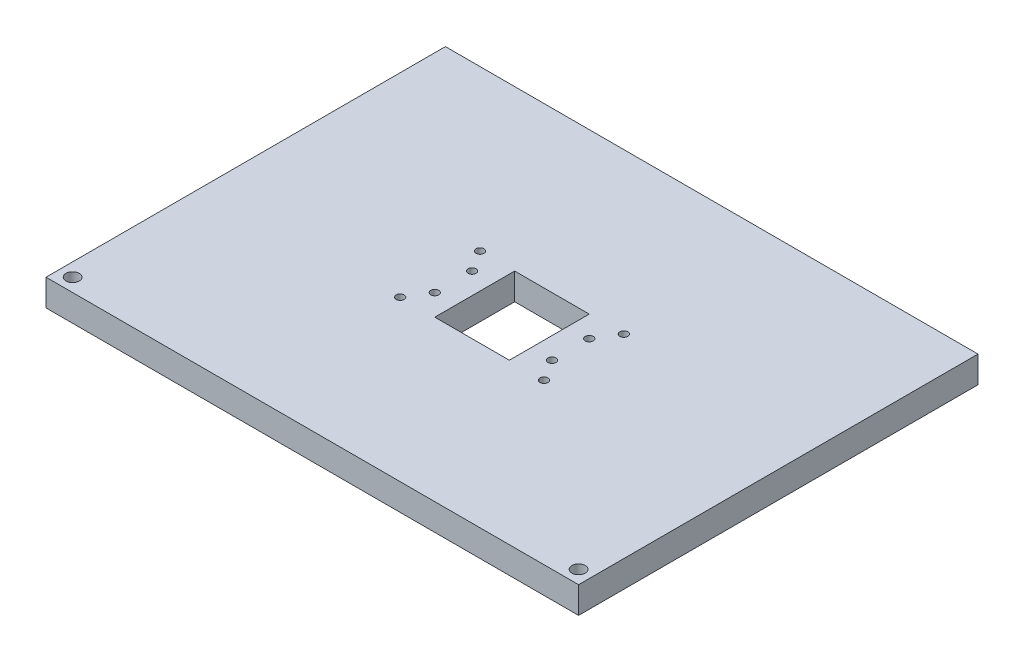
from build123d import *

# Parameters (mm, degrees)
SKETCH1_W           = 200
SKETCH1_H           = 60
BOSS_EXTRUDE1_DEPTH = 10
SKETCH2_W           = 200
SKETCH2_H           = 10
BOSS_EXTRUDE2_DEPTH = 140
SKETCH3_R           = 15.5
CUT_EXTRUDE1_DEPTH  = 60
SKETCH7_W           = 10
SKETCH7_H           = 30
CUT_EXTRUDE4_DEPTH  = 30
SKETCH9_R           = 1.5
SKETCH9_R_2         = 2.5
CUT_EXTRUDE6_DEPTH  = 20
SKETCH10_W          = 33.76561095
SKETCH10_H          = 62.627783557
CUT_EXTRUDE7_DEPTH  = 130
SKETCH11_W          = 8
SKETCH11_H          = 30
CUT_EXTRUDE8_DEPTH  = 30


with BuildPart() as part:
    # Sketch1 → Boss-Extrude1 (new body)
    with BuildSketch(Plane.XY):
        Rectangle(SKETCH1_W, SKETCH1_H)
    extrude(amount=BOSS_EXTRUDE1_DEPTH)

    # Sketch2 → Boss-Extrude2 (add)
    with BuildSketch(Plane(origin=(0, 0, 0), x_dir=(-1, 0, 0), z_dir=(0, 0, -1))):
        with Locations((0, -25)):
            Rectangle(SKETCH2_W, SKETCH2_H)
    extrude(amount=BOSS_EXTRUDE2_DEPTH)

    # Sketch3 → Cut-Extrude1 (cut)
    with BuildSketch(Plane.XY.offset(10)):
        with Locations((0, 5)):
            Circle(SKETCH3_R)
        with Locations((60, 5)):
            Circle(SKETCH3_R)
        with Locations((-60, 5)):
            Circle(SKETCH3_R)
    extrude(amount=-CUT_EXTRUDE1_DEPTH, mode=Mode.SUBTRACT)

    # Sketch7 → Cut-Extrude4 (cut)
    with BuildSketch(Plane(origin=(0, -20, 0), x_dir=(1, 0, 0), z_dir=(0, 1, 0))):
        with Locations((9, 65)):
            Rectangle(SKETCH7_W, SKETCH7_H)
        with Locations((-9, 65)):
            Rectangle(SKETCH7_W, SKETCH7_H)
    extrude(amount=-CUT_EXTRUDE4_DEPTH, mode=Mode.SUBTRACT)

    # Sketch9 → Cut-Extrude6 (cut)
    with BuildSketch(Plane(origin=(0, -20, 0), x_dir=(1, 0, 0), z_dir=(0, 1, 0))):
        with Locations(Location((-27, 80, 0), (0, 0, 270))):
            Circle(SKETCH9_R)
        with Locations(Location((27, 80, 0), (0, 0, 270))):
            Circle(SKETCH9_R)
        with Locations(Location((27, 50, 0), (0, 0, 270))):
            Circle(SKETCH9_R)
        with Locations(Location((-27, 50, 0), (0, 0, 270))):
            Circle(SKETCH9_R)
        with Locations(Location((-22, 72, 0), (0, 0, 270))):
            Circle(SKETCH9_R)
        with Locations(Location((-22, 58, 0), (0, 0, 270))):
            Circle(SKETCH9_R)
        with Locations(Location((22, 72, 0), (0, 0, 270))):
            Circle(SKETCH9_R)
        with Locations(Location((22, 58, 0), (0, 0, 270))):
            Circle(SKETCH9_R)
        with Locations(Location((95, -5, 0), (0, 0, 270))):
            Circle(SKETCH9_R_2)
        with Locations(Location((-95, -5, 0), (0, 0, 270))):
            Circle(SKETCH9_R_2)
    extrude(amount=-CUT_EXTRUDE6_DEPTH, mode=Mode.SUBTRACT)

    # Sketch10 → Cut-Extrude7 (cut, symmetric)
    with BuildSketch(Plane(origin=(0, 0, 0), x_dir=(0, 0, -1), z_dir=(1, 0, 0))):
        with Locations((-16.882805475, 11.313891779)):
            Rectangle(SKETCH10_W, SKETCH10_H)
    extrude(amount=CUT_EXTRUDE7_DEPTH, both=True, mode=Mode.SUBTRACT)

    # Sketch11 → Cut-Extrude8 (cut)
    with BuildSketch(Plane(origin=(0, -20, 0), x_dir=(1, 0, 0), z_dir=(0, 1, 0))):
        with Locations((0, 65)):
            Rectangle(SKETCH11_W, SKETCH11_H)
    extrude(amount=-CUT_EXTRUDE8_DEPTH, mode=Mode.SUBTRACT)


solid = part.part
